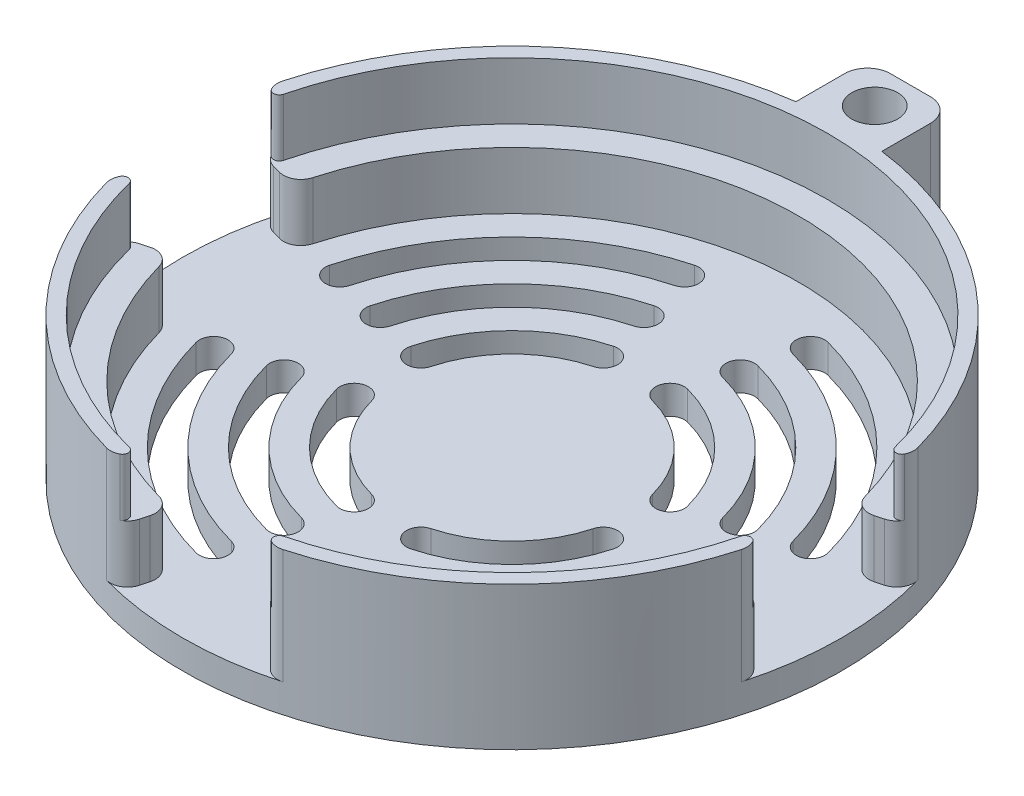
from build123d import *

# Parameters (mm, degrees)
CROQUIS1_R              = 57.5
SALIENTE_EXTRUIR1_DEPTH = 25
CROQUIS2_R              = 50
CORTAR_EXTRUIR1_DEPTH   = 20
SALIENTE_EXTRUIR2_START = -25
SALIENTE_EXTRUIR2_DEPTH = 25
REDONDEO1_R             = 4
CROQUIS4_R              = 55
CORTAR_EXTRUIR2_DEPTH   = 10
CORTAR_EXTRUIR3_DEPTH   = 93.393181567
MATRIZC1_COUNT          = 4
CORTAR_EXTRUIR4_REACH   = 95.603
REDONDEO2_R             = 3
REDONDEO3_R             = 3
REDONDEO4_R             = 1
MATRIZC2_COUNT          = 3
MATRIZC2_ANGLE          = 180
REDONDEO2_OF_MATRIZC2_R = 3
REDONDEO3_OF_MATRIZC2_R = 3
REDONDEO4_OF_MATRIZC2_R = 1
CROQUIS7_R              = 4
CORTAR_EXTRUIR5_DEPTH   = 94.602884645


with BuildPart() as part:
    # Croquis1 → Saliente-Extruir1 (new body)
    with BuildSketch(Plane(origin=(0, 0, 0), x_dir=(1, 0, 0), z_dir=(0, 1, 0))):
        with Locations(Location((0, 0, 0), (0, 0, 270))):
            Circle(CROQUIS1_R)
    extrude(amount=SALIENTE_EXTRUIR1_DEPTH)

    # Croquis2 → Cortar-Extruir1 (cut)
    with BuildSketch(Plane(origin=(0, 25, 0), x_dir=(1, 0, 0), z_dir=(0, 1, 0))):
        with Locations(Location((0, 0, 0), (0, 0, 270))):
            Circle(CROQUIS2_R)
    extrude(amount=-CORTAR_EXTRUIR1_DEPTH, mode=Mode.SUBTRACT)

    # Croquis3 → Saliente-Extruir2 (add)
    with BuildSketch(Plane(origin=(0, 25, 0), x_dir=(1, 0, 0), z_dir=(0, 1, 0)).offset(SALIENTE_EXTRUIR2_START)):
        with BuildLine():
            Line((-7.5, 57.008771255), (-7.5, 69.5))
            Line((-7.5, 69.5), (7.5, 69.5))
            Line((7.5, 69.5), (7.5, 57.008771255))
            ThreePointArc((7.5, 57.008771255), (0, 57.5), (-7.5, 57.008771255))
        make_face()
    extrude(amount=SALIENTE_EXTRUIR2_DEPTH)

    # Redondeo1
    redondeo1_edges = [part.edges().sort_by_distance(p)[0] for p in [
        (7.5, 12.5, -69.5),
        (-7.5, 12.5, -69.5),
    ]]
    fillet(redondeo1_edges, radius=REDONDEO1_R)

    # Croquis4 → Cortar-Extruir2 (cut)
    with BuildSketch(Plane(origin=(0, 25, 0), x_dir=(1, 0, 0), z_dir=(0, 1, 0))):
        with Locations(Location((0, 0, 0), (0, 0, 270))):
            Circle(CROQUIS4_R)
    extrude(amount=-CORTAR_EXTRUIR2_DEPTH, mode=Mode.SUBTRACT)

    # Croquis5 → Cortar-Extruir3 (cut, through all)
    with BuildSketch(Plane(origin=(0, 5, 0), x_dir=(1, 0, 0), z_dir=(0, 1, 0))):
        with BuildLine():
            ThreePointArc((-5.176380902, 19.318516526), (-3.408613949, 22.380378704), (-6.470476128, 24.148145657))
            ThreePointArc((-6.470476128, 24.148145657), (-17.67766953, 17.67766953), (-24.148145657, 6.470476128))
            ThreePointArc((-24.148145657, 6.470476128), (-22.380378704, 3.408613949), (-19.318516526, 5.176380902))
            ThreePointArc((-19.318516526, 5.176380902), (-14.142135624, 14.142135624), (-5.176380902, 19.318516526))
        make_face()
        with BuildLine():
            ThreePointArc((-7.764571353, 28.977774789), (-21.213203436, 21.213203436), (-28.977774789, 7.764571353))
            ThreePointArc((-28.977774789, 7.764571353), (-32.039636967, 5.9968044), (-33.80740392, 9.058666579))
            ThreePointArc((-33.80740392, 9.058666579), (-24.748737342, 24.748737342), (-9.058666579, 33.80740392))
            ThreePointArc((-9.058666579, 33.80740392), (-5.9968044, 32.039636967), (-7.764571353, 28.977774789))
        make_face()
        with BuildLine():
            ThreePointArc((-11.64685703, 43.466662183), (-31.819805153, 31.819805153), (-43.466662183, 11.64685703))
            ThreePointArc((-43.466662183, 11.64685703), (-41.69889523, 8.584994851), (-38.637033052, 10.352761804))
            ThreePointArc((-38.637033052, 10.352761804), (-28.284271247, 28.284271247), (-10.352761804, 38.637033052))
            ThreePointArc((-10.352761804, 38.637033052), (-8.584994851, 41.69889523), (-11.64685703, 43.466662183))
        make_face()
    cortar_extruir3 = extrude(amount=-CORTAR_EXTRUIR3_DEPTH, mode=Mode.SUBTRACT)

    # MatrizC1: Cortar-Extruir3 ×4 about axis
    matrizc1_axis = Axis((0, 0, 0), (0, 1, 0))
    for i in range(1, MATRIZC1_COUNT):
        add(cortar_extruir3.rotate(matrizc1_axis, i * 360 / MATRIZC1_COUNT), mode=Mode.SUBTRACT)

    # Cortar-Extruir4: up to this face of the body (flat: up to its plane)
    cortar_extruir4_end = Plane(part.part.faces().sort_by_distance((0, 5, 0))[0])
    # Croquis6 → Cortar-Extruir4 (cut, up to the picked face)
    with BuildSketch(Plane(origin=(0, 25, 0), x_dir=(1, 0, 0), z_dir=(0, 1, 0)), mode=Mode.PRIVATE) as cortar_extruir4_sk1:
        Polygon((-71.161592337, 16.479500748), (-16.636313028, 1.86949619), (-15.78023969, -1.64011203), (-63.577939744, -14.44746716), align=None)
    cortar_extruir4_tool1 = split(extrude(cortar_extruir4_sk1.sketch, amount=-CORTAR_EXTRUIR4_REACH, mode=Mode.PRIVATE), bisect_by=cortar_extruir4_end, keep=Keep.BOTH, mode=Mode.PRIVATE)
    cortar_extruir4 = cortar_extruir4_tool1.solids().sort_by(Axis((-48.577913, 25, -0.685184), (0, -1, 0)))[0]
    add(cortar_extruir4, mode=Mode.SUBTRACT)

    # Redondeo2
    redondeo2_edges = [part.edges().sort_by_distance(p)[0] for p in [
        (-48.882930784, 10, -10.509951376),
        (-56.135261823, 15, -12.453207621),
    ]]
    fillet(redondeo2_edges, radius=REDONDEO2_R)

    # Redondeo3
    redondeo3_edges = [part.edges().sort_by_distance(p)[0] for p in [
        (-48.882930784, 10, 10.509951376),
        (-56.135261823, 15, 12.453207621),
    ]]
    fillet(redondeo3_edges, radius=REDONDEO3_R)

    # Redondeo4
    redondeo4_edges = [part.edges().sort_by_distance(p)[0] for p in [
        (-53.710853389, 20, -11.838252752),
        (-53.710853389, 20, 11.838252752),
    ]]
    fillet(redondeo4_edges, radius=REDONDEO4_R)

    # MatrizC2: Cortar-Extruir4 ×3 about axis
    matrizc2_axis = Axis((0, 0, 0), (0, 1, 0))
    for i in range(1, MATRIZC2_COUNT):
        add(cortar_extruir4.rotate(matrizc2_axis, i * MATRIZC2_ANGLE / (MATRIZC2_COUNT - 1)), mode=Mode.SUBTRACT)

    # Redondeo2 of MatrizC2
    redondeo2_of_matrizc2_edges = [part.edges().sort_by_distance(p)[0] for p in [
        (-10.509951376, 10, 48.882930784),
        (-12.453207621, 15, 56.135261823),
        (48.882930784, 10, 10.509951376),
        (56.135261823, 15, 12.453207621),
    ]]
    fillet(redondeo2_of_matrizc2_edges, radius=REDONDEO2_OF_MATRIZC2_R)

    # Redondeo3 of MatrizC2
    redondeo3_of_matrizc2_edges = [part.edges().sort_by_distance(p)[0] for p in [
        (10.509951376, 10, 48.882930784),
        (12.453207621, 15, 56.135261823),
        (48.882930784, 10, -10.509951376),
        (56.135261823, 15, -12.453207621),
    ]]
    fillet(redondeo3_of_matrizc2_edges, radius=REDONDEO3_OF_MATRIZC2_R)

    # Redondeo4 of MatrizC2
    redondeo4_of_matrizc2_edges = [part.edges().sort_by_distance(p)[0] for p in [
        (-11.838252752, 20, 53.710853389),
        (11.838252752, 20, 53.710853389),
        (53.710853389, 20, 11.838252752),
        (53.710853389, 20, -11.838252752),
    ]]
    fillet(redondeo4_of_matrizc2_edges, radius=REDONDEO4_OF_MATRIZC2_R)

    # Croquis7 → Cortar-Extruir5 (cut, through all)
    with BuildSketch(Plane(origin=(0, 25, 0), x_dir=(1, 0, 0), z_dir=(0, 1, 0))):
        with Locations(Location((0, 63.254385627, 0), (0, 0, 270))):
            Circle(CROQUIS7_R)
    extrude(amount=-CORTAR_EXTRUIR5_DEPTH, mode=Mode.SUBTRACT)


solid = part.part
